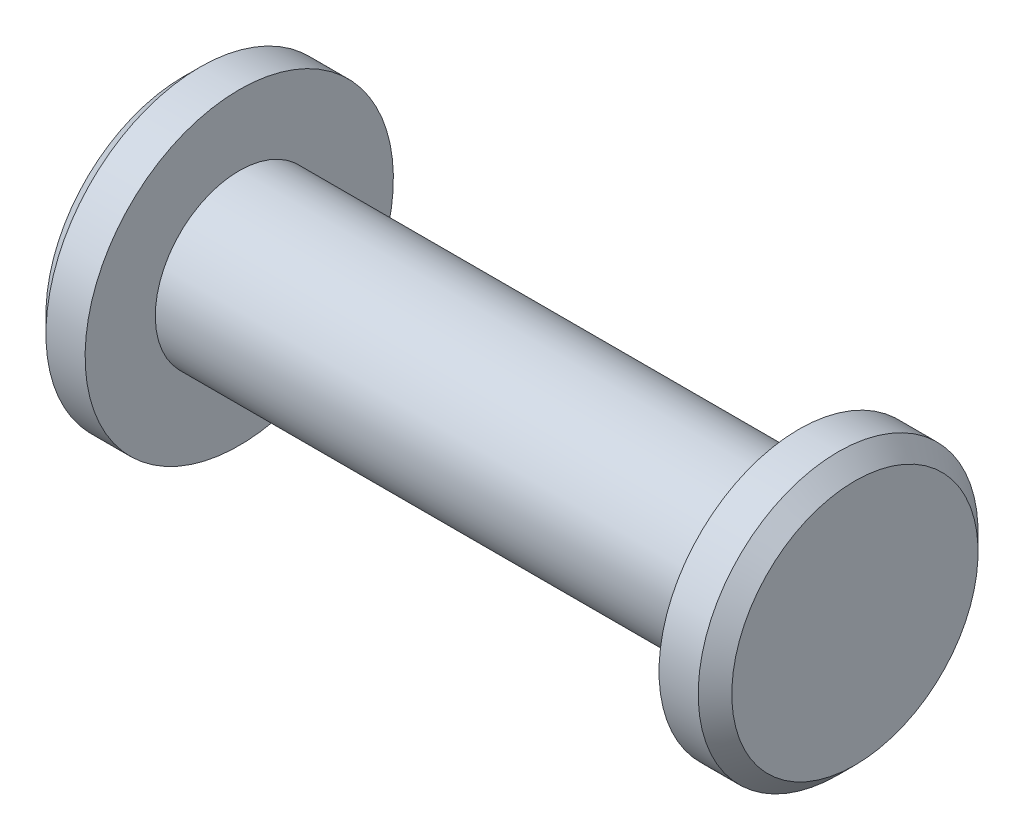
from build123d import *

# Parameters (mm, degrees)
CHAMFER1_SIZE = 3


with BuildPart() as part:
    # Sketch1 → Revolve1 (revolve)
    with BuildSketch(Plane.XY):
        Polygon((0, 0), (-120, 0), (-120, 27.5382263), (-110, 27.5382263), (-110, 15), (-10, 15), (-10, 25), (0, 25), align=None)
    revolve(axis=Axis((0, 0, 0), (-1, 0, 0)))

    # Chamfer1
    chamfer1_edges = [part.edges().sort_by_distance(p)[0] for p in [
        (0, -25, 0),
        (-120, -27.5382263, 0),
    ]]
    chamfer(chamfer1_edges, length=CHAMFER1_SIZE)


solid = part.part
